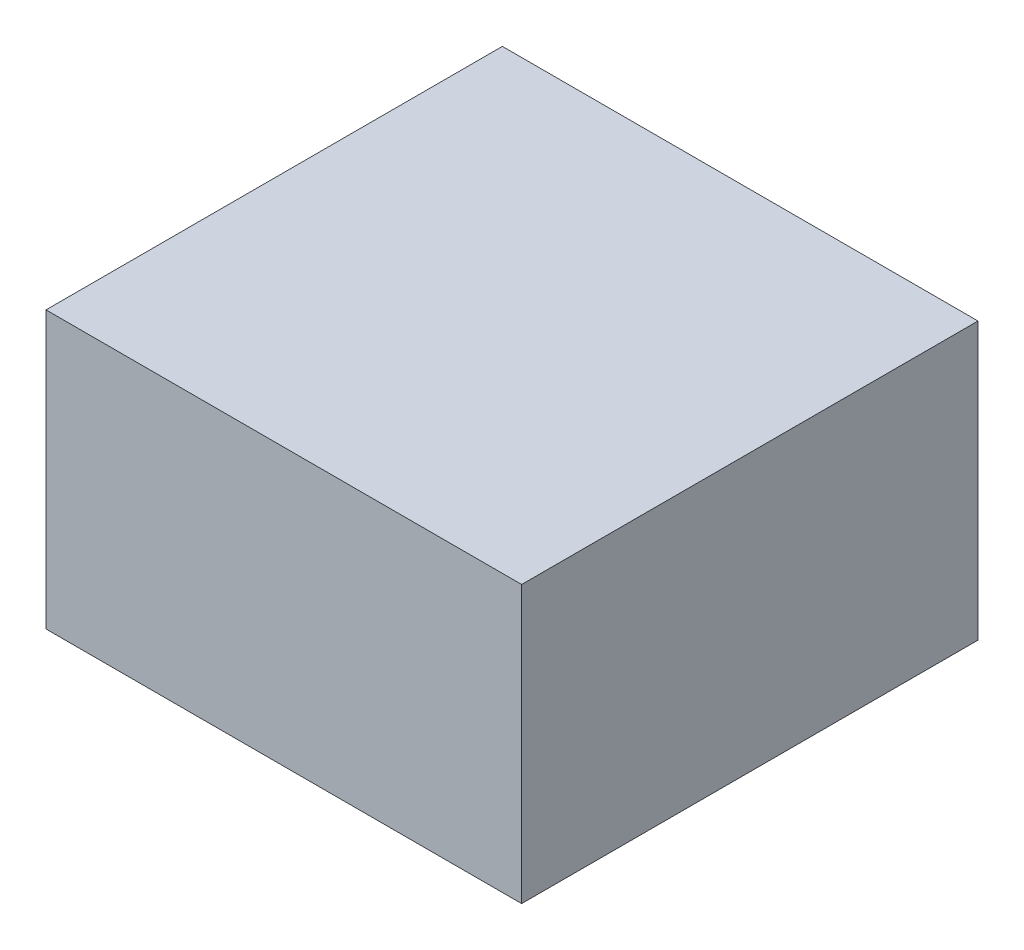
from build123d import *

# Parameters (mm, degrees)
SKETCH1_W           = 74
SKETCH1_H           = 71
BOSS_EXTRUDE1_DEPTH = 43


with BuildPart() as part:
    # Sketch1 → Boss-Extrude1 (new body)
    with BuildSketch(Plane(origin=(0, 0, 0), x_dir=(1, 0, 0), z_dir=(0, 1, 0))):
        with Locations((37, 35.5)):
            Rectangle(SKETCH1_W, SKETCH1_H)
    extrude(amount=BOSS_EXTRUDE1_DEPTH)


solid = part.part
